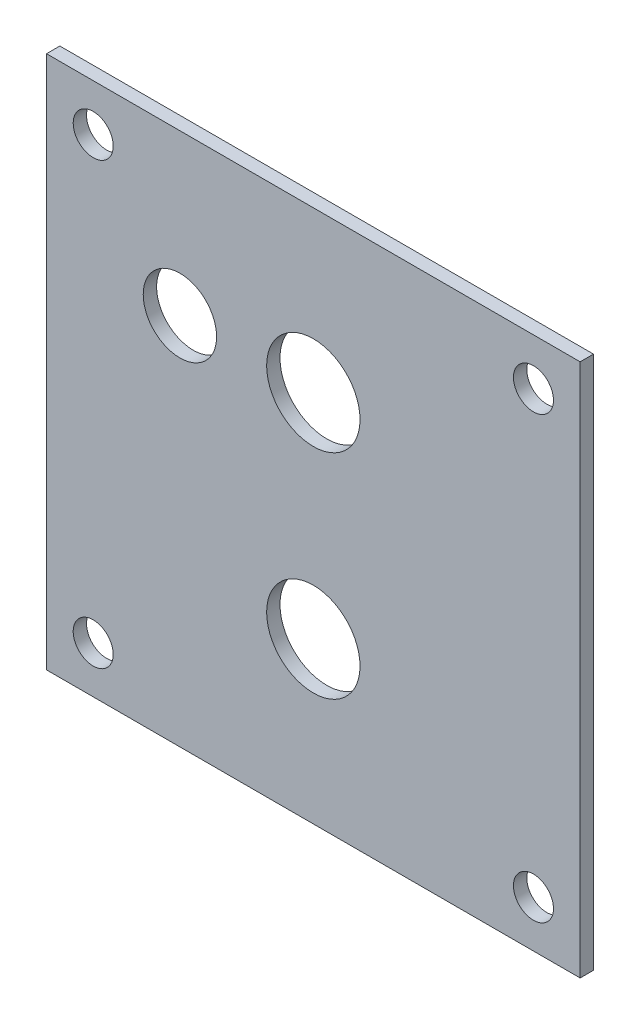
from build123d import *

# Parameters (mm, degrees)
SKETCH1_W           = 127
SKETCH1_H           = 127
BOSS_EXTRUDE1_DEPTH = 3.175
SKETCH2_R           = 11.1125
SKETCH2_R_2         = 8.73125
CUT_EXTRUDE1_DEPTH  = 3.175
SKETCH3_R           = 4.7625
CUT_EXTRUDE2_DEPTH  = 3.175


with BuildPart() as part:
    # Sketch1 → Boss-Extrude1 (new body)
    with BuildSketch(Plane.XY):
        Rectangle(SKETCH1_W, SKETCH1_H)
    extrude(amount=BOSS_EXTRUDE1_DEPTH)

    # Sketch2 → Cut-Extrude1 (cut)
    with BuildSketch(Plane(origin=(0, 0, 0), x_dir=(-1, 0, 0), z_dir=(0, 0, -1))):
        with Locations((0, 25.4)):
            Circle(SKETCH2_R)
        with Locations((31.75, 25.4)):
            Circle(SKETCH2_R_2)
        with Locations((0, -25.4)):
            Circle(SKETCH2_R)
    extrude(amount=-CUT_EXTRUDE1_DEPTH, mode=Mode.SUBTRACT)

    # Sketch3 → Cut-Extrude2 (cut)
    with BuildSketch(Plane(origin=(0, 0, 0), x_dir=(-1, 0, 0), z_dir=(0, 0, -1))):
        with Locations((52.3875, 52.3875)):
            Circle(SKETCH3_R)
        with Locations(Location((52.3875, -52.3875, 0), (0, 0, 180))):
            Circle(SKETCH3_R)
        with Locations(Location((-52.3875, 52.3875, 0), (0, 0, 180))):
            Circle(SKETCH3_R)
        with Locations((-52.3875, -52.3875)):
            Circle(SKETCH3_R)
    extrude(amount=-CUT_EXTRUDE2_DEPTH, mode=Mode.SUBTRACT)


solid = part.part
